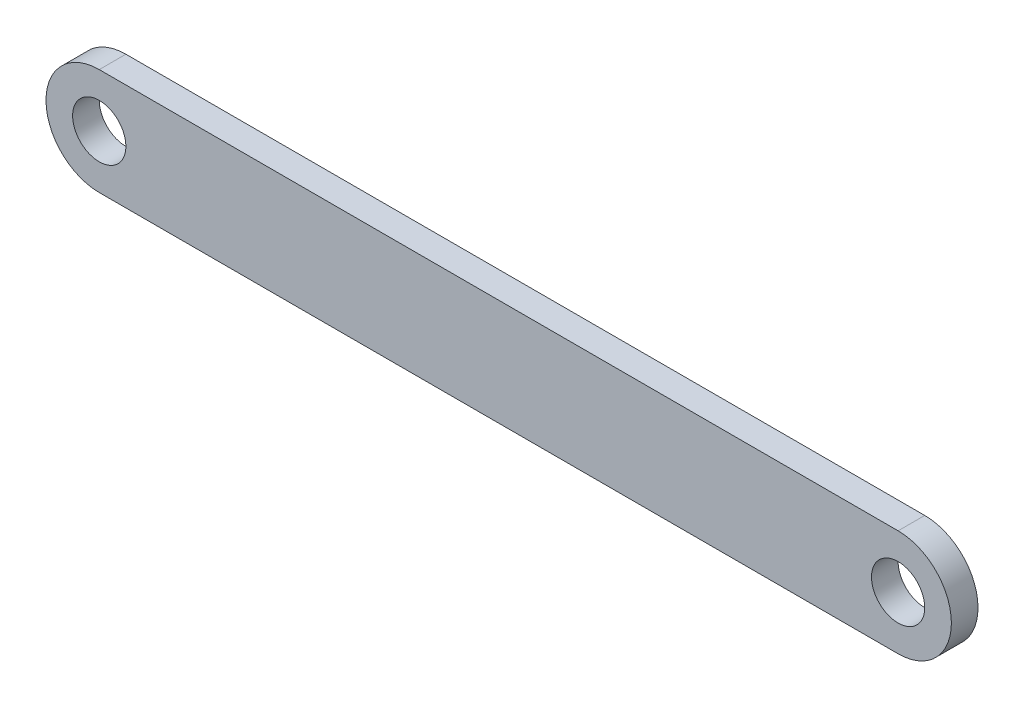
from build123d import *

# Parameters (mm, degrees)
IZIM3_R                     = 5
Y_KSEKLIK_EKSTR_ZYON1_DEPTH = 5


with BuildPart() as part:
    # Çizim3 → Yükseklik-Ekstrüzyon1 (new body)
    with BuildSketch(Plane.XY):
        with BuildLine():
            Line((-102.884615385, 29.230769231), (47.115384615, 29.230769231))
            ThreePointArc((47.115384615, 29.230769231), (57.115384615, 19.230769231), (47.115384615, 9.230769231))
            Line((47.115384615, 9.230769231), (-102.884615385, 9.230769231))
            ThreePointArc((-102.884615385, 9.230769231), (-112.884615385, 19.230769231), (-102.884615385, 29.230769231))
        make_face()
        with Locations((-102.884615385, 19.230769231)):
            Circle(IZIM3_R, mode=Mode.SUBTRACT)
        with Locations((47.115384615, 19.230769231)):
            Circle(IZIM3_R, mode=Mode.SUBTRACT)
    extrude(amount=Y_KSEKLIK_EKSTR_ZYON1_DEPTH)


solid = part.part
